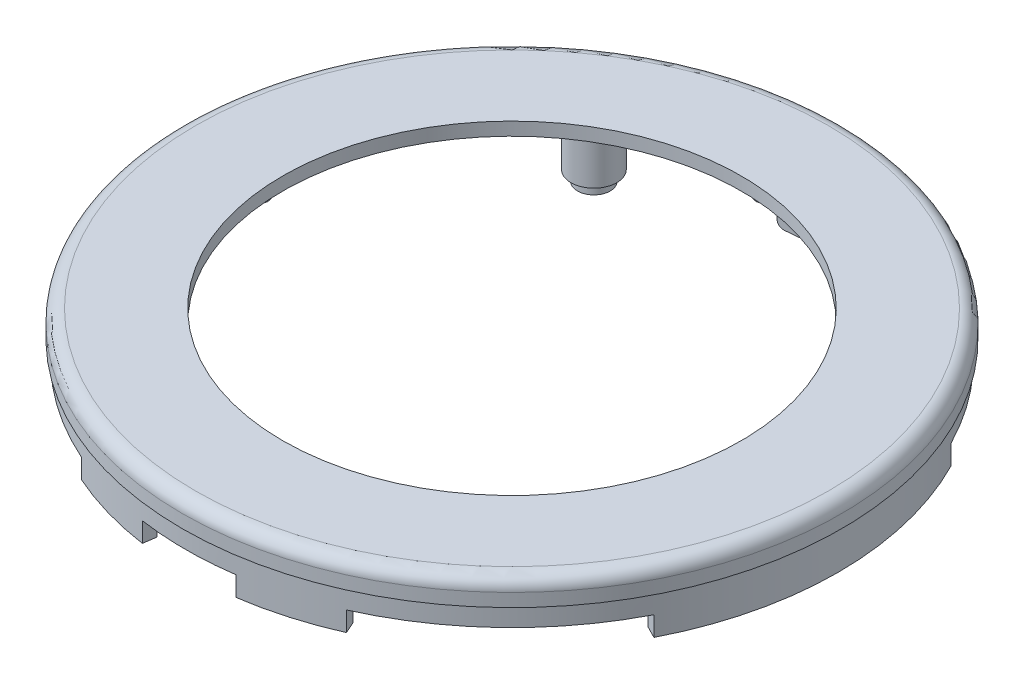
from build123d import *
from build123d.topology import SkipClean

# Parameters (mm, degrees)
SKETCH_1_R          = 50
EXTRUDE_1_DEPTH     = 4
SHELL_1_T           = -2
SKETCH_2_R          = 49.8
SKETCH_2_R_2        = 47.8
EXTRUDE_2_DEPTH     = 5
SKETCH_5_R          = 2.5
SKETCH_5_R_2        = 1.25
EXTRUDE_3_DEPTH     = 9
SKETCH_4_R          = 35
CUT_EXTRUDE_1_DEPTH = 10
EXTRUDE_4_DEPTH     = 3
EXTRUDE_START       = -1.6
SKETCH_13_R         = 3.5
SKETCH_13_R_2       = 2.5
EXTRUDE_7_DEPTH     = 7.4
EXTRUDE_7_2_DEPTH   = 7.4
EXTRUDE_7_3_DEPTH   = 7.4
EXTRUDE_7_4_DEPTH   = 7.4
SKETCH_15_R         = 1.25
EXTRUDE_9_DEPTH     = 2.5
EXTRUDE_11_DEPTH    = 3
EXTRUDE_14_DEPTH    = 5
FILLET_2_R          = 2
EXTRUDE_START_2     = -4
SKETCH_30_R         = 50.3
SKETCH_30_R_2       = 50
EXTRUDE_15_DEPTH    = 4
FILLET_3_R          = 2
EXTRUDE_18_DEPTH    = 6.35
EXTRUDE_19_DEPTH    = 12.35
FILLET_4_R          = 1
FILLET_5_R          = 1
CUT_EXTRUDE_START   = -45
CUT_EXTRUDE_2_DEPTH = 10
CHAMFER_1_SIZE      = 0.3


with BuildPart() as part:
    # Эскиз1 → Бобышка-Вытянуть1 (new body)
    with BuildSketch(Plane(origin=(0, 0, 0), x_dir=(1, 0, 0), z_dir=(0, 1, 0))):
        with Locations(Location((0, 0, 0), (0, 0, 270))):
            Circle(SKETCH_1_R)
    extrude(amount=EXTRUDE_1_DEPTH)

    # Оболочка1
    shell_1_openings = [part.faces().sort_by_distance(p)[0] for p in [
        (0, 0, 0),
    ]]
    offset(amount=SHELL_1_T, openings=shell_1_openings, kind=Kind.INTERSECTION)

    # Эскиз2 → Бобышка-Вытянуть2 (add)
    with BuildSketch(Plane.XZ.offset(-2)):
        with Locations(Location((0, 0, 0), (0, 0, 90))):
            Circle(SKETCH_2_R)
        with Locations(Location((0, 0, 0), (0, 0, 270))):
            Circle(SKETCH_2_R_2, mode=Mode.SUBTRACT)
    extrude(amount=EXTRUDE_2_DEPTH)

    # Эскиз5 → Бобышка-Вытянуть3 (add)
    # profile 1 of 4: a face of its own
    with BuildSketch(Plane.XZ.offset(-2)):
        with Locations(Location((-21.5, 34, 0), (0, 0, 90))):
            Circle(SKETCH_5_R)
        with Locations(Location((-21.5, 34, 0), (0, 0, 270))):
            Circle(SKETCH_5_R_2, mode=Mode.SUBTRACT)
    # profile 2 of 4: a face of its own
    with BuildSketch(Plane.XZ.offset(-2)):
        with Locations(Location((21.5, 34, 0), (0, 0, 90))):
            Circle(SKETCH_5_R)
        with Locations(Location((21.5, 34, 0), (0, 0, 270))):
            Circle(SKETCH_5_R_2, mode=Mode.SUBTRACT)
    # profile 3 of 4: a face of its own
    with BuildSketch(Plane.XZ.offset(-2)):
        with Locations(Location((21.5, -34, 0), (0, 0, 90))):
            Circle(SKETCH_5_R)
        with Locations(Location((21.5, -34, 0), (0, 0, 90))):
            Circle(SKETCH_5_R_2, mode=Mode.SUBTRACT)
    # profile 4 of 4: a face of its own
    with BuildSketch(Plane.XZ.offset(-2)):
        with Locations(Location((-21.5, -34, 0), (0, 0, 90))):
            Circle(SKETCH_5_R)
        with Locations(Location((-21.5, -34, 0), (0, 0, 90))):
            Circle(SKETCH_5_R_2, mode=Mode.SUBTRACT)
    extrude(amount=EXTRUDE_3_DEPTH)

    # Эскиз4 → Вырез-Вытянуть1 (cut)
    with BuildSketch(Plane(origin=(0, 4, 0), x_dir=(1, 0, 0), z_dir=(0, 1, 0))):
        with Locations(Location((0, 0, 0), (0, 0, 270))):
            Circle(SKETCH_4_R)
    extrude(amount=-CUT_EXTRUDE_1_DEPTH, mode=Mode.SUBTRACT)

    # Эскиз7 → Бобышка-Вытянуть4 (add)
    with SkipClean():  # the faces are left unmerged after this step: merging them gives an invalid solid
        with BuildSketch(Plane.XZ.offset(3)):
            with BuildLine():
                Line((-42.558124254, 21.763411037), (-43.626529047, 22.309772821))
                Line((-43.626529047, 22.309772821), (-44.338798909, 22.67401401))
                ThreePointArc((-44.338798909, 22.67401401), (-49.8, 0), (-44.338798909, -22.67401401))
                Line((-44.338798909, -22.67401401), (-43.626529047, -22.309772821))
                Line((-43.626529047, -22.309772821), (-42.558124254, -21.763411037))
                ThreePointArc((-42.558124254, -21.763411037), (-47.8, 0), (-42.558124254, 21.763411037))
            make_face()
            with BuildLine():
                Line((-19.421613168, 43.676549108), (-19.909185047, 44.773031512))
                Line((-19.909185047, 44.773031512), (-20.234232966, 45.504019782))
                ThreePointArc((-20.234232966, 45.504019782), (-13.81233626, 47.846205357), (-7.130200452, 49.286917549))
                Line((-7.130200452, 49.286917549), (-7.015659079, 48.495159838))
                Line((-7.015659079, 48.495159838), (-6.84384702, 47.30752327))
                ThreePointArc((-6.84384702, 47.30752327), (-13.25762396, 45.924671005), (-19.421613168, 43.676549108))
            make_face()
            with BuildLine():
                Line((6.84384702, 47.30752327), (7.015659079, 48.495159838))
                Line((7.015659079, 48.495159838), (7.130200452, 49.286917549))
                ThreePointArc((7.130200452, 49.286917549), (13.81233626, 47.846205357), (20.234232966, 45.504019782))
                Line((20.234232966, 45.504019782), (19.909185047, 44.773031512))
                Line((19.909185047, 44.773031512), (19.421613168, 43.676549108))
                ThreePointArc((19.421613168, 43.676549108), (13.25762396, 45.924671005), (6.84384702, 47.30752327))
            make_face()
            with BuildLine():
                Line((42.558124254, 21.763411037), (43.626529047, 22.309772821))
                Line((43.626529047, 22.309772821), (44.338798909, 22.67401401))
                ThreePointArc((44.338798909, 22.67401401), (49.8, 0), (44.338798909, -22.67401401))
                Line((44.338798909, -22.67401401), (43.626529047, -22.309772821))
                Line((43.626529047, -22.309772821), (42.558124254, -21.763411037))
                ThreePointArc((42.558124254, -21.763411037), (47.8, 0), (42.558124254, 21.763411037))
            make_face()
            with BuildLine():
                Line((19.421613168, -43.676549108), (19.909185047, -44.773031512))
                Line((19.909185047, -44.773031512), (20.234232966, -45.504019782))
                ThreePointArc((20.234232966, -45.504019782), (13.81233626, -47.846205357), (7.130200452, -49.286917549))
                Line((7.130200452, -49.286917549), (7.015659079, -48.495159838))
                Line((7.015659079, -48.495159838), (6.84384702, -47.30752327))
                ThreePointArc((6.84384702, -47.30752327), (13.25762396, -45.924671005), (19.421613168, -43.676549108))
            make_face()
            with BuildLine():
                Line((-6.84384702, -47.30752327), (-7.015659079, -48.495159838))
                Line((-7.015659079, -48.495159838), (-7.130200452, -49.286917549))
                ThreePointArc((-7.130200452, -49.286917549), (-13.81233626, -47.846205357), (-20.234232966, -45.504019782))
                Line((-20.234232966, -45.504019782), (-19.909185047, -44.773031512))
                Line((-19.909185047, -44.773031512), (-19.421613168, -43.676549108))
                ThreePointArc((-19.421613168, -43.676549108), (-13.25762396, -45.924671005), (-6.84384702, -47.30752327))
            make_face()
        extrude(amount=EXTRUDE_4_DEPTH)

    # Эскиз15 → Бобышка-Вытянуть9 (add)
    with SkipClean():  # the faces are left unmerged after this step: merging them gives an invalid solid
        with BuildSketch(Plane.XZ.offset(-2)):
            with Locations(Location((0, 38.5, 0), (0, 0, 90))):
                Circle(SKETCH_15_R)
            with Locations(Location((38.5, 0, 0), (0, 0, 90))):
                Circle(SKETCH_15_R)
            with Locations(Location((0, -38.5, 0), (0, 0, 90))):
                Circle(SKETCH_15_R)
            with Locations(Location((-38.5, 0, 0), (0, 0, 90))):
                Circle(SKETCH_15_R)
        extrude(amount=EXTRUDE_9_DEPTH)

    # Эскиз18 → Бобышка-Вытянуть11 (add)
    with SkipClean():  # the faces are left unmerged after this step: merging them gives an invalid solid
        with BuildSketch(Plane.XZ.offset(3)):
            with BuildLine():
                Line((-7.130200452, -49.286917549), (-6.84384702, -47.30752327))
                ThreePointArc((-6.84384702, -47.30752327), (0, -47.8), (6.84384702, -47.30752327))
                Line((6.84384702, -47.30752327), (7.130200452, -49.286917549))
                ThreePointArc((7.130200452, -49.286917549), (0, -49.8), (-7.130200452, -49.286917549))
            make_face()
        extrude(amount=EXTRUDE_11_DEPTH)

    # Эскиз26 → Бобышка-Вытянуть14 (add)
    with SkipClean():  # the faces are left unmerged after this step: merging them gives an invalid solid
        with BuildSketch(Plane.XZ.offset(-2)):
            with BuildLine():
                Line((12.291960175, 46.192507131), (12.291910784, 46.19233601))
                Line((12.291910784, 46.19233601), (11.514173422, 43.497801712))
                ThreePointArc((11.514173422, 43.497801712), (12.478090295, 43.231357941), (13.43573173, 42.943172405))
                Line((13.43573173, 42.943172405), (14.213469092, 45.637706704))
                Line((14.213469092, 45.637706704), (14.213518484, 45.637877824))
                ThreePointArc((14.213518484, 45.637877824), (13.255640428, 45.925243569), (12.291960175, 46.192507131))
            make_face()
            with BuildLine():
                Line((-12.291960175, -46.192507131), (-12.291910784, -46.19233601))
                Line((-12.291910784, -46.19233601), (-11.514173422, -43.497801712))
                ThreePointArc((-11.514173422, -43.497801712), (-12.478090295, -43.231357941), (-13.43573173, -42.943172405))
                Line((-13.43573173, -42.943172405), (-14.213469092, -45.637706704))
                Line((-14.213469092, -45.637706704), (-14.213518484, -45.637877824))
                ThreePointArc((-14.213518484, -45.637877824), (-13.255640428, -45.925243569), (-12.291960175, -46.192507131))
            make_face()
            with BuildLine():
                Line((14.213518484, -45.637877824), (13.43573173, -42.943172405))
                ThreePointArc((13.43573173, -42.943172405), (12.478090295, -43.231357941), (11.514173422, -43.497801712))
                Line((11.514173422, -43.497801712), (12.291910784, -46.19233601))
                Line((12.291910784, -46.19233601), (12.291960175, -46.192507131))
                ThreePointArc((12.291960175, -46.192507131), (13.255640428, -45.925243569), (14.213518484, -45.637877824))
            make_face()
            with BuildLine():
                Line((-14.213518484, 45.637877824), (-14.213469092, 45.637706704))
                Line((-14.213469092, 45.637706704), (-13.43573173, 42.943172405))
                ThreePointArc((-13.43573173, 42.943172405), (-12.478090295, 43.231357941), (-11.514173422, 43.497801712))
                Line((-11.514173422, 43.497801712), (-12.291910784, 46.19233601))
                Line((-12.291910784, 46.19233601), (-12.291960175, 46.192507131))
                ThreePointArc((-12.291960175, 46.192507131), (-13.255640428, 45.925243569), (-14.213518484, 45.637877824))
            make_face()
            with BuildLine():
                Line((44.984830147, -1), (47.789538604, -1))
                ThreePointArc((47.789538604, -1), (47.8, 0), (47.789538604, 1))
                Line((47.789538604, 1), (44.984830147, 1))
                ThreePointArc((44.984830147, 1), (44.996144799, 0), (44.984830147, -1))
            make_face()
            with BuildLine():
                Line((-44.984830147, 1), (-47.789360498, 1))
                Line((-47.789360498, 1), (-47.789538604, 1))
                ThreePointArc((-47.789538604, 1), (-47.8, 0), (-47.789538604, -1))
                Line((-47.789538604, -1), (-44.984830147, -1))
                ThreePointArc((-44.984830147, -1), (-44.996144799, 0), (-44.984830147, 1))
            make_face()
        extrude(amount=EXTRUDE_14_DEPTH)

    # Эскиз27 → Вырез-Повернуть1 (revolve, cut)
    with SkipClean():  # the faces are left unmerged after this step: merging them gives an invalid solid
        with BuildSketch(Plane.XY, mode=Mode.PRIVATE) as cut_revolve_1_sk:
            with BuildLine():
                Line((-44.984830147, -3), (-44.984830147, 2))
                ThreePointArc((-44.984830147, 2), (-46.827578368, -0.252964649), (-47.789538604, -3))
                Line((-47.789538604, -3), (-44.984830147, -3))
            make_face()
        revolve(cut_revolve_1_sk.sketch.rotate(Axis((0, 0, 0), (0, -1, 0)), 278.231711068), axis=Axis((0, 0, 0), (0, -1, 0)), mode=Mode.SUBTRACT)

    # Скругление2
    fillet_2_edges = [part.edges().sort_by_distance(p)[0] for p in [
        (-38.199866573, 2, 28.73343338),
        (0, 2, 47.8),
        (38.199866573, 2, -28.73343338),
        (38.199866573, 2, 28.73343338),
        (-6.198312639, 2, -47.396423076),
        (-38.199866573, 2, -28.73343338),
    ]]
    fillet(fillet_2_edges, radius=FILLET_2_R)


with BuildPart() as body_2:
    # Эскиз13 → Бобышка-Вытянуть7 (new body)
    with BuildSketch(Plane.XZ.offset(7).offset(EXTRUDE_START)):
        with Locations(Location((-21.5, 34, 0), (0, 0, 270))):
            Circle(SKETCH_13_R)
        with Locations(Location((-21.5, 34, 0), (0, 0, 270))):
            Circle(SKETCH_13_R_2, mode=Mode.SUBTRACT)
    extrude(amount=-EXTRUDE_7_DEPTH)


    add(part.part)  # Бобышка-Вытянуть15 merges part


with BuildPart() as body_3:
    # Эскиз13 → Extrude 7 2 (new body)
    with BuildSketch(Plane.XZ.offset(7).offset(EXTRUDE_START)):
        with Locations(Location((21.5, 34, 0), (0, 0, 270))):
            Circle(SKETCH_13_R)
        with Locations(Location((21.5, 34, 0), (0, 0, 270))):
            Circle(SKETCH_13_R_2, mode=Mode.SUBTRACT)
    extrude(amount=-EXTRUDE_7_2_DEPTH)


with BuildPart() as body_4:
    # Эскиз13 → Extrude 7 3 (new body)
    with BuildSketch(Plane.XZ.offset(7).offset(EXTRUDE_START)):
        with Locations(Location((21.5, -34, 0), (0, 0, 90))):
            Circle(SKETCH_13_R)
        with Locations(Location((21.5, -34, 0), (0, 0, 90))):
            Circle(SKETCH_13_R_2, mode=Mode.SUBTRACT)
    extrude(amount=-EXTRUDE_7_3_DEPTH)


with BuildPart() as body_5:
    # Эскиз13 → Extrude 7 4 (new body)
    with BuildSketch(Plane.XZ.offset(7).offset(EXTRUDE_START)):
        with Locations(Location((-21.5, -34, 0), (0, 0, 90))):
            Circle(SKETCH_13_R)
        with Locations(Location((-21.5, -34, 0), (0, 0, 90))):
            Circle(SKETCH_13_R_2, mode=Mode.SUBTRACT)
    extrude(amount=-EXTRUDE_7_4_DEPTH)


with BuildPart() as body_2_1:
    add(body_2.part)

    add(body_3.part)  # Бобышка-Вытянуть15 merges body 3
    # Эскиз30 → Бобышка-Вытянуть15 (add)
    with BuildSketch(Plane(origin=(0, 4, 0), x_dir=(1, 0, 0), z_dir=(0, 1, 0)).offset(EXTRUDE_START_2)):
        with Locations(Location((0, 0, 0), (0, 0, 270))):
            Circle(SKETCH_30_R)
        Circle(SKETCH_30_R_2, mode=Mode.SUBTRACT)
    extrude(amount=EXTRUDE_15_DEPTH)

    # Скругление3
    fillet_3_edges = [body_2_1.edges().sort_by_distance(p)[0] for p in [
        (0, 4, -50.3),
    ]]
    fillet(fillet_3_edges, radius=FILLET_3_R)

    # Эскиз28 → Бобышка-Вытянуть18 (add)
    with SkipClean():  # the faces are left unmerged after this step: merging them gives an invalid solid
        with BuildSketch(Plane.XZ.offset(6)):
            with BuildLine():
                Line((-6.84384702, -47.30752327), (-7.130200452, -49.286917549))
                ThreePointArc((-7.130200452, -49.286917549), (0, -49.8), (7.130200452, -49.286917549))
                Line((7.130200452, -49.286917549), (6.84384702, -47.30752327))
                ThreePointArc((6.84384702, -47.30752327), (4.761735774, -47.562231575), (2.670454545, -47.725346227))
                ThreePointArc((2.670454545, -47.725346227), (0.042530612, -47.799981079), (-2.585521975, -47.730022796))
                ThreePointArc((-2.585521975, -47.730022796), (-4.719414834, -47.566449559), (-6.84384702, -47.30752327))
            make_face()
        extrude(amount=EXTRUDE_18_DEPTH)

    # Эскиз33 → Бобышка-Вытянуть19 (add)
    with SkipClean():  # the faces are left unmerged after this step: merging them gives an invalid solid
        with BuildSketch(Plane.XZ):
            with BuildLine():
                Line((-7.130200452, -49.286917549), (-7.20178881, -49.781766119))
                ThreePointArc((-7.20178881, -49.781766119), (0, -50.3), (7.20178881, -49.781766119))
                Line((7.20178881, -49.781766119), (7.130200452, -49.286917549))
                ThreePointArc((7.130200452, -49.286917549), (0, -49.8), (-7.130200452, -49.286917549))
            make_face()
        extrude(amount=EXTRUDE_19_DEPTH)

    # Скругление4
    fillet_4_edges = [body_2_1.edges().sort_by_distance(p)[0] for p in [
        (-6.987023736, -12.35, -48.29722041),
    ]]
    fillet(fillet_4_edges, radius=FILLET_4_R)

    # Скругление5
    fillet_5_edges = [body_2_1.edges().sort_by_distance(p)[0] for p in [
        (6.987023736, -12.35, -48.29722041),
    ]]
    fillet(fillet_5_edges, radius=FILLET_5_R)

    # Эскиз32 → Вырез-Вытянуть2 (cut)
    with SkipClean():  # the faces are left unmerged after this step: merging them gives an invalid solid
        with BuildSketch(Plane.XY.offset(CUT_EXTRUDE_START)):
            with BuildLine():
                Line((0, -10), (3, -10))
                ThreePointArc((3, -10), (4.5, -8.5), (3, -7))
                Line((3, -7), (0, -7))
                Line((0, -7), (-3, -7))
                ThreePointArc((-3, -7), (-4.5, -8.5), (-3, -10))
                Line((-3, -10), (0, -10))
            make_face()
        extrude(amount=-CUT_EXTRUDE_2_DEPTH, mode=Mode.SUBTRACT)

    # Фаска1
    chamfer_1_edges = [body_2_1.edges().sort_by_distance(p)[0] for p in [
        (21.5, -7, 35.25),
        (21.5, 2, 35.25),
        (-21.5, -7, 35.25),
        (21.5, -7, -35.25),
        (-21.5, -7, -35.25),
    ]]
    chamfer(chamfer_1_edges, length=CHAMFER_1_SIZE)


solid = Compound([body_4.part, body_5.part, body_2_1.part])
